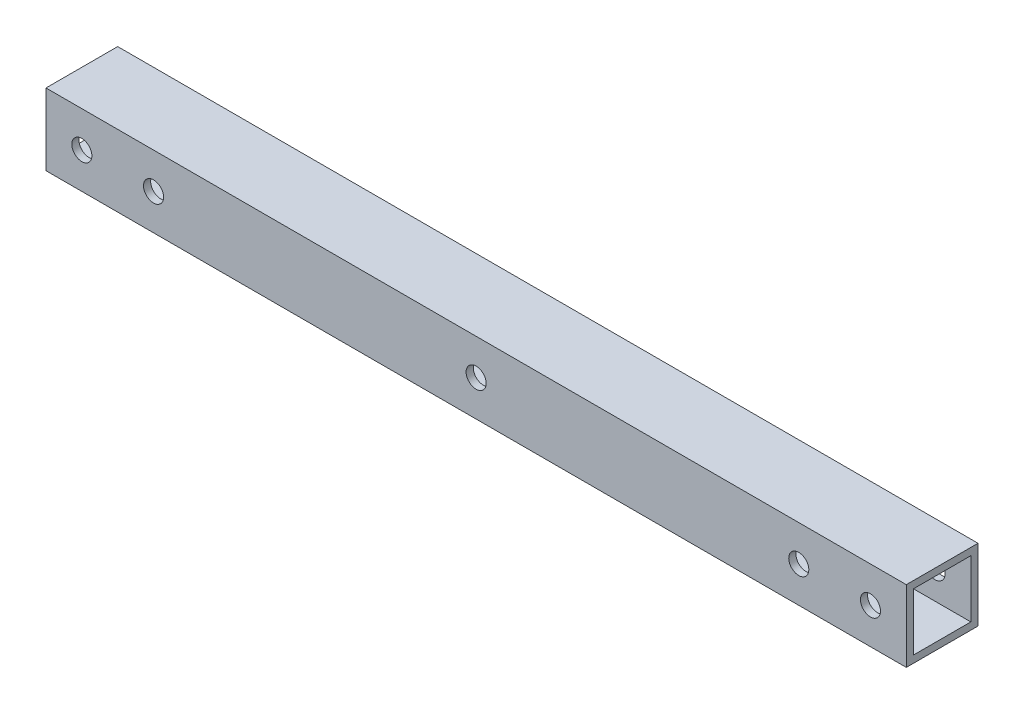
from build123d import *

# Parameters (mm, degrees)
SKETCH_1_W          = 15
SKETCH_1_H          = 15
SKETCH_1_W_2        = 12
SKETCH_1_H_2        = 12
EXTRUDE_1_DEPTH     = 180
SKETCH_2_R          = 2.1
CUT_EXTRUDE_1_DEPTH = 181.779561898


with BuildPart() as part:
    # ｽｹｯﾁ1 → 押し出し-薄板1 (new body)
    with BuildSketch(Plane(origin=(0, 0, 0), x_dir=(0, 0, -1), z_dir=(1, 0, 0))):
        Rectangle(SKETCH_1_W, SKETCH_1_H)
        Rectangle(SKETCH_1_W_2, SKETCH_1_H_2, mode=Mode.SUBTRACT)
    extrude(amount=EXTRUDE_1_DEPTH)

    # ｽｹｯﾁ2 → ｶｯﾄ - 押し出し1 (cut, through all)
    with BuildSketch(Plane.XY.offset(7.5)):
        with Locations((22.5, 0)):
            Circle(SKETCH_2_R)
        with Locations((7.5, 0)):
            Circle(SKETCH_2_R)
        with Locations(Location((172.5, 0, 0), (0, 0, 90))):
            Circle(SKETCH_2_R)
        with Locations(Location((157.5, 0, 0), (0, 0, 90))):
            Circle(SKETCH_2_R)
        with Locations((90, 0)):
            Circle(SKETCH_2_R)
    extrude(amount=-CUT_EXTRUDE_1_DEPTH, mode=Mode.SUBTRACT)


solid = part.part
